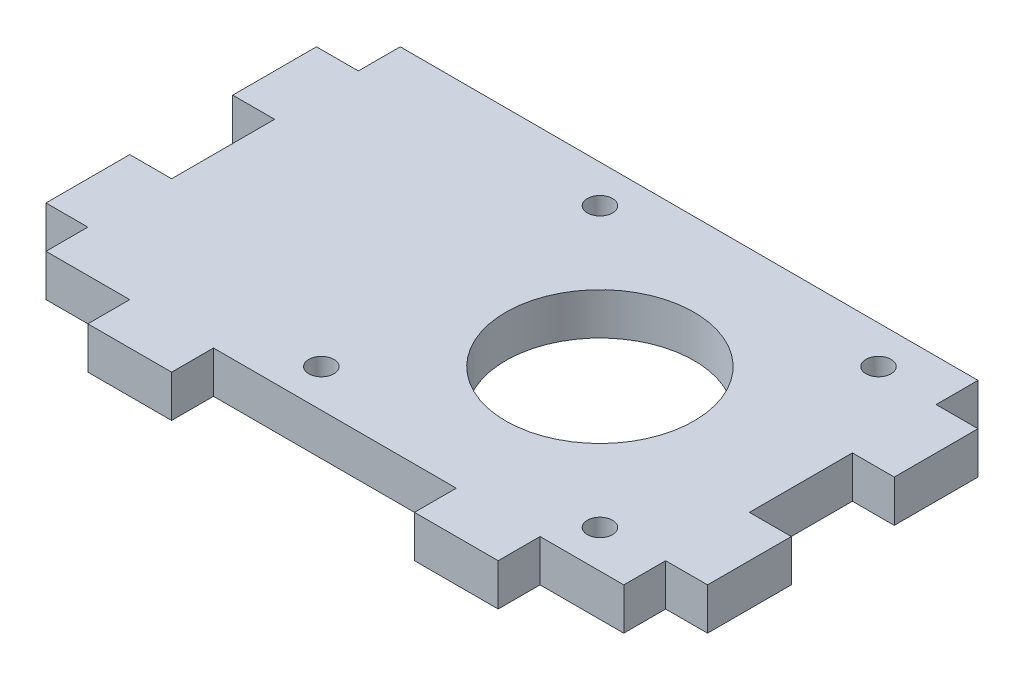
from build123d import *

# Parameters (mm, degrees)
SKETCH_1_R      = 11.25
SKETCH_1_R_2    = 1.5
EXTRUDE_1_DEPTH = 5


with BuildPart() as part:
    # 草图1 → 凸台-拉伸1 (new body)
    with BuildSketch(Plane(origin=(0, 0, 0), x_dir=(1, 0, 0), z_dir=(0, 1, 0))):
        Polygon((-34.5, 21.15), (34.5, 21.15), (34.5, 16.15), (39.5, 16.15), (39.5, 6.15), (34.5, 6.15), (34.5, -6.15), (39.5, -6.15), (39.5, -16.15), (34.5, -16.15), (34.5, -21.15), (24.5, -21.15), (24.5, -26.15), (14.5, -26.15), (14.5, -21.15), (-14.5, -21.15), (-14.5, -26.15), (-24.5, -26.15), (-24.5, -21.15), (-34.5, -21.15), (-34.5, -16.15), (-39.5, -16.15), (-39.5, -6.15), (-34.5, -6.15), (-34.5, 6.15), (-39.5, 6.15), (-39.5, 16.15), (-34.5, 16.15), align=None)
        with Locations(Location((10.5, 0, 0), (0, 0, 270))):
            Circle(SKETCH_1_R, mode=Mode.SUBTRACT)
        with Locations(Location((-6.134831461, 16.634831461, 0), (0, 0, 270))):
            Circle(SKETCH_1_R_2, mode=Mode.SUBTRACT)
        with Locations(Location((27.134831461, 16.634831461, 0), (0, 0, 270))):
            Circle(SKETCH_1_R_2, mode=Mode.SUBTRACT)
        with Locations(Location((-6.134831461, -16.634831461, 0), (0, 0, 270))):
            Circle(SKETCH_1_R_2, mode=Mode.SUBTRACT)
        with Locations(Location((27.134831461, -16.634831461, 0), (0, 0, 270))):
            Circle(SKETCH_1_R_2, mode=Mode.SUBTRACT)
    extrude(amount=EXTRUDE_1_DEPTH)


solid = part.part
